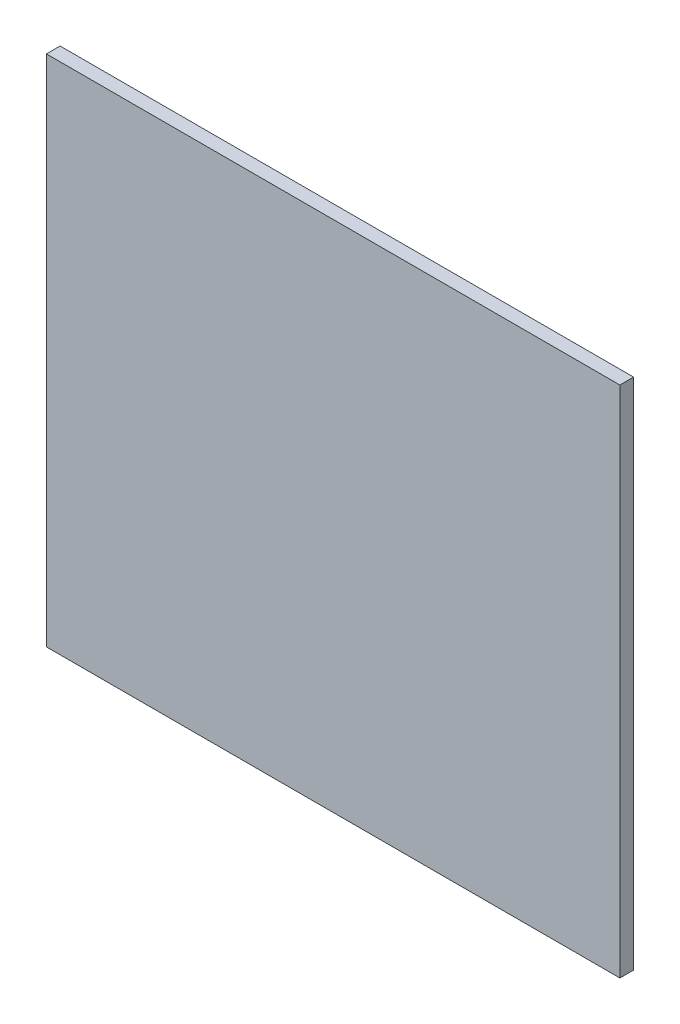
from build123d import *

# Parameters (mm, degrees)
SKETCH1_W           = 212.725
SKETCH1_H           = 190.5
BOSS_EXTRUDE1_DEPTH = 5.08


with BuildPart() as part:
    # Sketch1 → Boss-Extrude1 (new body)
    with BuildSketch(Plane.XY):
        Rectangle(SKETCH1_W, SKETCH1_H)
    extrude(amount=BOSS_EXTRUDE1_DEPTH)


solid = part.part
